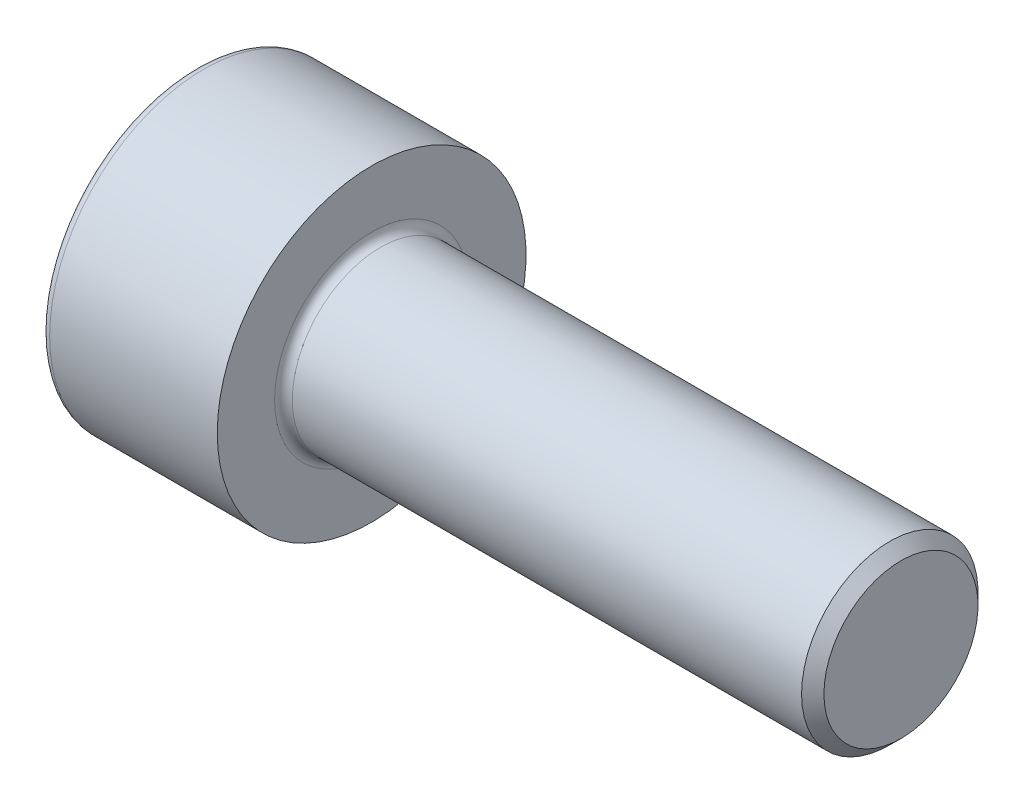
from build123d import *

# Parameters (mm, degrees)
CUT_EXTRUDE1_DEPTH = 2


with BuildPart() as part:
    # Sketch1 → Revolve1 (revolve)
    with BuildSketch(Plane.XY, mode=Mode.PRIVATE) as revolve1_sk:
        with BuildLine():
            Line((11.7465, 2), (0.2, 2))
            ThreePointArc((0.2, 2), (0.058578644, 2.058578644), (0, 2.2))
            Line((0, 2.2), (0, 3.5))
            Line((0, 3.5), (-3.8, 3.5))
            ThreePointArc((-3.8, 3.5), (-3.941421356, 3.441421356), (-4, 3.3))
            Line((-4, 3.3), (-4, 0))
            Line((-4, 0), (12, 0))
            Line((12, 0), (12, 1.7465))
            Line((12, 1.7465), (11.7465, 2))
        make_face()
    revolve(revolve1_sk.sketch.rotate(Axis((-4, 0, 0), (1, 0, 0)), 90), axis=Axis((-4, 0, 0), (1, 0, 0)))

    # Sketch2 → Cut-Extrude1 (cut)
    with BuildSketch(Plane.ZY.offset(4)):
        Polygon((1.535, 0.886232663), (0, 1.772465326), (-1.535, 0.886232663), (-1.535, -0.886232663), (0, -1.772465326), (1.535, -0.886232663), align=None)
    extrude(amount=-CUT_EXTRUDE1_DEPTH, mode=Mode.SUBTRACT)


solid = part.part
